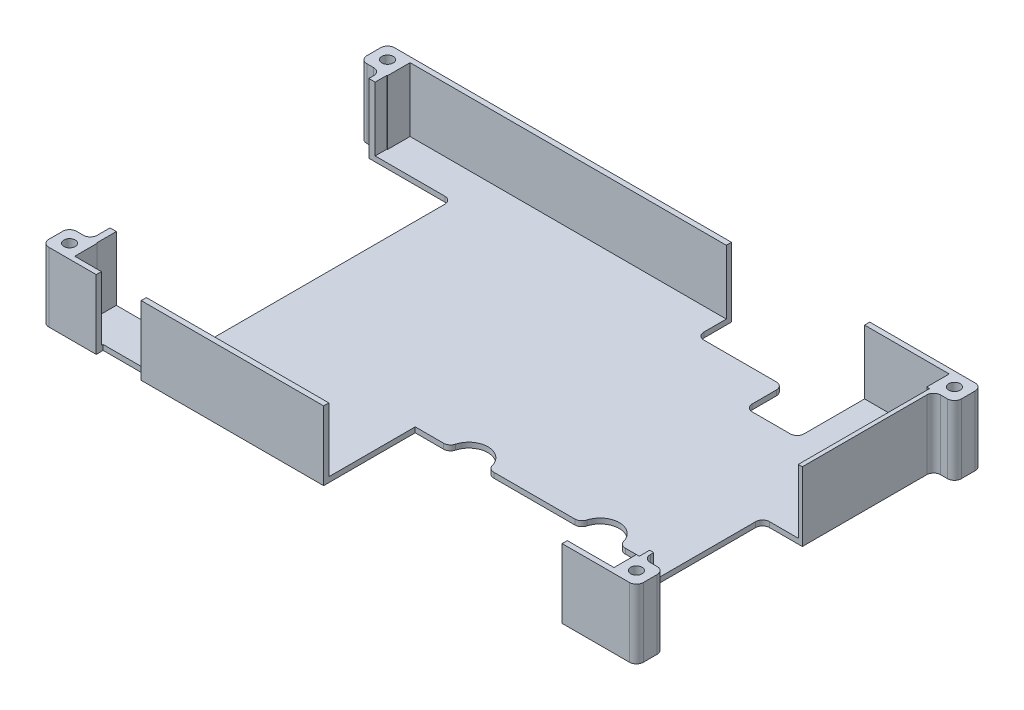
from build123d import *

# Parameters (mm, degrees)
SKETCH1_W           = 160
SKETCH1_H           = 100
BOSS_EXTRUDE1_DEPTH = 1.5
SKETCH2_W           = 160
SKETCH2_H           = 100
SKETCH2_W_2         = 157
SKETCH2_H_2         = 97
BOSS_EXTRUDE2_DEPTH = 20
FILLET1_R           = 2
SKETCH4_W           = 15
SKETCH4_H           = 21
CUT_EXTRUDE1_DEPTH  = 190.73665961
SKETCH5_W           = 69
SKETCH5_H           = 26.5
CUT_EXTRUDE2_DEPTH  = 190.73665961
SKETCH6_W           = 11.5
SKETCH6_H           = 43
CUT_EXTRUDE3_DEPTH  = 190.73665961
CUT_EXTRUDE5_DEPTH  = 10
FILLET2_R           = 2
SKETCH10_W          = 13
SKETCH10_H          = 2
CUT_EXTRUDE6_DEPTH  = 20
FILLET4_R           = 2
SKETCH11_W          = 25
SKETCH11_H          = 10
CUT_EXTRUDE7_DEPTH  = 20
FILLET5_R           = 2
SKETCH12_W          = 8
SKETCH12_H          = 8
SKETCH12_R          = 1.65
BOSS_EXTRUDE3_DEPTH = 20
FILLET6_R           = 2
SKETCH14_W          = 24
SKETCH14_H          = 64.876727664
CUT_EXTRUDE8_DEPTH  = 22
SKETCH16_W          = 24
SKETCH16_H          = 5
CUT_EXTRUDE9_DEPTH  = 20
FILLET8_R           = 2
SKETCH18_W          = 24
SKETCH18_H          = 5
CUT_EXTRUDE10_DEPTH = 20
FILLET9_R           = 2


with BuildPart() as part:
    # Sketch1 → Boss-Extrude1 (new body)
    with BuildSketch(Plane(origin=(0, 0, 0), x_dir=(1, 0, 0), z_dir=(0, 1, 0))):
        with Locations((80, 50)):
            Rectangle(SKETCH1_W, SKETCH1_H)
    extrude(amount=BOSS_EXTRUDE1_DEPTH)

    # Sketch2 → Boss-Extrude2 (add)
    with BuildSketch(Plane(origin=(0, 0, 0), x_dir=(1, 0, 0), z_dir=(0, 1, 0))):
        with Locations((80, 50)):
            Rectangle(SKETCH2_W, SKETCH2_H)
        with Locations((80.326409395, 50)):
            Rectangle(SKETCH2_W_2, SKETCH2_H_2, mode=Mode.SUBTRACT)
    extrude(amount=BOSS_EXTRUDE2_DEPTH)

    # Fillet1
    fillet1_edges = [part.edges().sort_by_distance(p)[0] for p in [
        (0, 10, -100),
        (160, 10, -100),
        (160, 10, 0),
        (0, 10, 0),
    ]]
    fillet(fillet1_edges, radius=FILLET1_R)

    # Sketch4 → Cut-Extrude1 (cut, through all)
    with BuildSketch(Plane.XZ):
        with Locations((126, -89.5)):
            Rectangle(SKETCH4_W, SKETCH4_H)
    extrude(amount=-CUT_EXTRUDE1_DEPTH, mode=Mode.SUBTRACT)

    # Sketch5 → Cut-Extrude2 (cut, through all)
    with BuildSketch(Plane.XZ):
        with Locations((110, -13.25)):
            Rectangle(SKETCH5_W, SKETCH5_H)
    extrude(amount=-CUT_EXTRUDE2_DEPTH, mode=Mode.SUBTRACT)

    # Sketch6 → Cut-Extrude3 (cut, through all)
    with BuildSketch(Plane.XZ):
        with Locations((154.25, -32.5)):
            Rectangle(SKETCH6_W, SKETCH6_H)
    extrude(amount=-CUT_EXTRUDE3_DEPTH, mode=Mode.SUBTRACT)

    # Sketch9 → Cut-Extrude5 (cut)
    with BuildSketch(Plane.XZ):
        with BuildLine():
            Line((134.539408017, -26.5), (123.460591983, -26.5))
            ThreePointArc((123.460591983, -26.5), (129, -32.039408017), (134.539408017, -26.5))
        make_face()
        with BuildLine():
            Line((96.539, -26.5), (85.461, -26.5))
            ThreePointArc((85.461, -26.5), (91, -32.039), (96.539, -26.5))
        make_face()
    extrude(amount=-CUT_EXTRUDE5_DEPTH, mode=Mode.SUBTRACT)

    # Fillet2
    fillet2_edges = [part.edges().sort_by_distance(p)[0] for p in [
        (85.461, 0.75, -26.5),
        (96.539, 0.75, -26.5),
        (123.460591983, 0.75, -26.5),
        (134.539408017, 0.75, -26.5),
    ]]
    fillet(fillet2_edges, radius=FILLET2_R)

    # Sketch10 → Cut-Extrude6 (cut)
    with BuildSketch(Plane.XZ):
        with Locations((16.208817875, -1)):
            Rectangle(SKETCH10_W, SKETCH10_H)
    extrude(amount=-CUT_EXTRUDE6_DEPTH, mode=Mode.SUBTRACT)

    # Fillet4
    fillet4_edges = [part.edges().sort_by_distance(p)[0] for p in [
        (148.5, 0.75, -54),
        (148.5, 0.75, -11),
        (118.5, 0.75, -79),
        (133.5, 0.75, -79),
    ]]
    fillet(fillet4_edges, radius=FILLET4_R)

    # Sketch11 → Cut-Extrude7 (cut)
    with BuildSketch(Plane.XZ):
        with Locations((106, -95)):
            Rectangle(SKETCH11_W, SKETCH11_H)
    extrude(amount=-CUT_EXTRUDE7_DEPTH, mode=Mode.SUBTRACT)

    # Fillet5
    fillet5_edges = [part.edges().sort_by_distance(p)[0] for p in [
        (118.5, 0.75, -90),
        (93.5, 0.75, -90),
    ]]
    fillet(fillet5_edges, radius=FILLET5_R)

    # Sketch12 → Boss-Extrude3 (add)
    # profile 1 of 4: a face of its own
    with BuildSketch(Plane.XZ):
        with Locations((-2, -4)):
            Rectangle(SKETCH12_W, SKETCH12_H)
        with Locations(Location((-2, -4, 0), (0, 0, 90))):
            Circle(SKETCH12_R, mode=Mode.SUBTRACT)
    # profile 2 of 4: a face of its own
    with BuildSketch(Plane.XZ):
        with Locations((162, -96)):
            Rectangle(SKETCH12_W, SKETCH12_H)
        with Locations(Location((162, -96, 0), (0, 0, 270))):
            Circle(SKETCH12_R, mode=Mode.SUBTRACT)
    # profile 3 of 4: a face of its own
    with BuildSketch(Plane.XZ):
        with Locations((162, -4)):
            Rectangle(SKETCH12_W, SKETCH12_H)
        with Locations(Location((162, -4, 0), (0, 0, 270))):
            Circle(SKETCH12_R, mode=Mode.SUBTRACT)
    # profile 4 of 4: a face of its own
    with BuildSketch(Plane.XZ):
        with Locations((-2, -96)):
            Rectangle(SKETCH12_W, SKETCH12_H)
        with Locations(Location((-2, -96, 0), (0, 0, 90))):
            Circle(SKETCH12_R, mode=Mode.SUBTRACT)
    extrude(amount=-BOSS_EXTRUDE3_DEPTH)

    # Fillet6
    fillet6_edges = [part.edges().sort_by_distance(p)[0] for p in [
        (160, 10, -92),
        (166, 10, -92),
        (166, 10, -100),
        (166, 10, -8),
        (160, 10, -8),
        (166, 10, 0),
        (0, 10, -8),
        (-6, 10, -8),
        (-6, 10, 0),
        (-6, 10, -92),
        (0, 10, -92),
        (-6, 10, -100),
    ]]
    fillet(fillet6_edges, radius=FILLET6_R)

    # Sketch14 → Cut-Extrude8 (cut)
    with BuildSketch(Plane.XZ):
        with Locations((12, -51.145467828)):
            Rectangle(SKETCH14_W, SKETCH14_H)
    extrude(amount=-CUT_EXTRUDE8_DEPTH, mode=Mode.SUBTRACT)

    # Sketch16 → Cut-Extrude9 (cut)
    with BuildSketch(Plane.XZ):
        with Locations((12, -86.08383166)):
            Rectangle(SKETCH16_W, SKETCH16_H)
    extrude(amount=-CUT_EXTRUDE9_DEPTH, mode=Mode.SUBTRACT)

    # Fillet8
    fillet8_edges = [part.edges().sort_by_distance(p)[0] for p in [
        (24, 0.75, -88.58383166),
    ]]
    fillet(fillet8_edges, radius=FILLET8_R)

    # Sketch18 → Cut-Extrude10 (cut)
    with BuildSketch(Plane.XZ):
        with Locations((12, -16.207103996)):
            Rectangle(SKETCH18_W, SKETCH18_H)
    extrude(amount=-CUT_EXTRUDE10_DEPTH, mode=Mode.SUBTRACT)

    # Fillet9
    fillet9_edges = [part.edges().sort_by_distance(p)[0] for p in [
        (24, 0.75, -13.707103996),
    ]]
    fillet(fillet9_edges, radius=FILLET9_R)


solid = part.part
